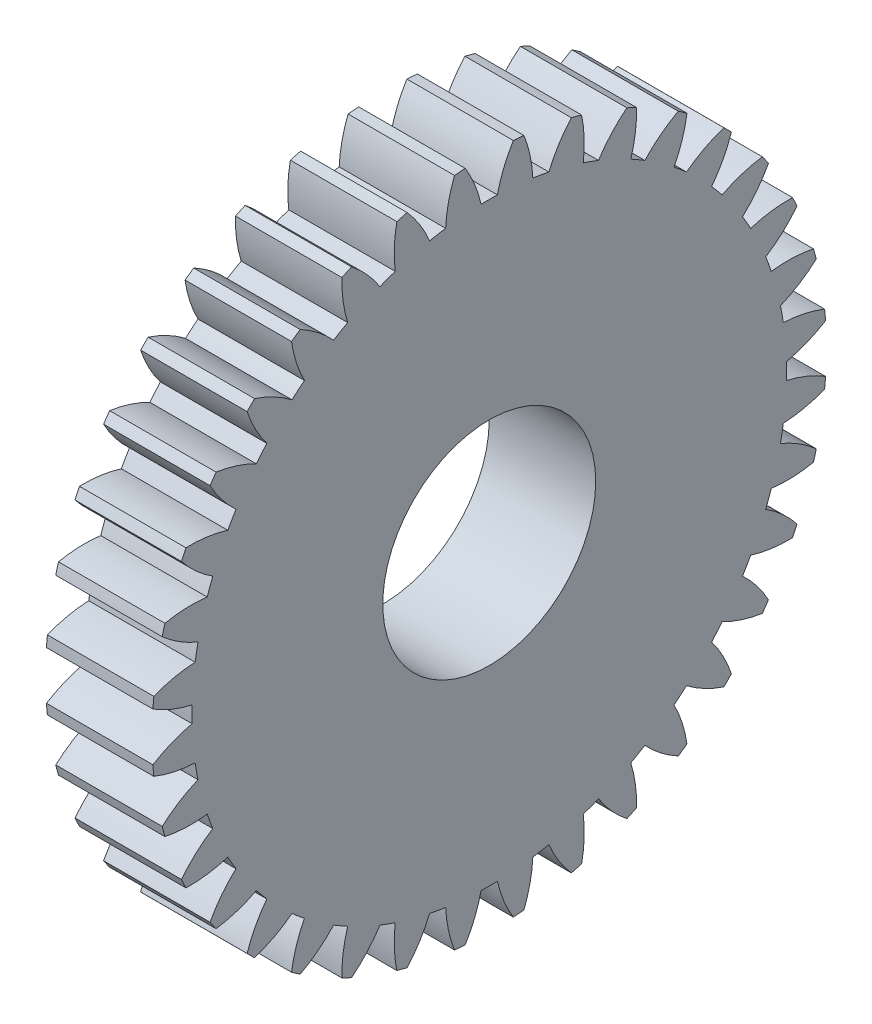
from build123d import *

# Parameters (mm, degrees)
BASPROSKE_W         = 6.35
BASPROSKE_H         = 20.108333333
TOOTHCUT_DEPTH      = 30.137821451
TEETHCUTS_COUNT     = 36
TEETHCUTS_ANGLE     = 350
BORSKE_R            = 9.525
BORE_DEPTH          = 50.8000508
SKETCH1_R           = 9.525
SKETCH1_R_2         = 6.35
BOSS_EXTRUDE1_DEPTH = 6.35


with BuildPart() as part:
    # BasProSke → Base-Revolve (revolve)
    with BuildSketch(Plane(origin=(0, 0, 0), x_dir=(1, 0, 0), z_dir=(0, 1, 0)), mode=Mode.PRIVATE) as base_revolve_sk:
        with Locations((3.175, 10.054166667)):
            Rectangle(BASPROSKE_W, BASPROSKE_H)
    revolve(base_revolve_sk.sketch.rotate(Axis((-10, 0, 0), (1, 0, 0)), 180), axis=Axis((-10, 0, 0), (1, 0, 0)))

    # TooCutSke → ToothCut (cut, through all)
    with BuildSketch(Plane(origin=(0, 0, 0), x_dir=(0, 0, -1), z_dir=(1, 0, 0))):
        with BuildLine():
            ThreePointArc((0.485894828, 17.722540418), (0, 17.7292), (-0.485894828, 17.722540418))
            ThreePointArc((-0.485894828, 17.722540418), (-0.869820886, 18.942611253), (-1.452410194, 20.081277912))
            ThreePointArc((-1.452410194, 20.081277912), (0, 20.133733333), (1.452410194, 20.081277912))
            ThreePointArc((1.452410194, 20.081277912), (0.869820886, 18.942611253), (0.485894828, 17.722540418))
        make_face()
    toothcut = extrude(amount=TOOTHCUT_DEPTH, mode=Mode.SUBTRACT)

    # TeethCuts: ToothCut ×36 about axis
    teethcuts_axis = Axis((-10, 0, 0), (1, 0, 0))
    for i in range(1, TEETHCUTS_COUNT):
        add(toothcut.rotate(teethcuts_axis, i * TEETHCUTS_ANGLE / (TEETHCUTS_COUNT - 1)), mode=Mode.SUBTRACT)

    # BorSke → Bore (cut, symmetric)
    with BuildSketch(Plane(origin=(0, 0, 0), x_dir=(0, 0, -1), z_dir=(1, 0, 0))):
        with Locations(Location((0, 0, 0), (0, 0, 180))):
            Circle(BORSKE_R)
    extrude(amount=BORE_DEPTH, both=True, mode=Mode.SUBTRACT)

    # Sketch1 → Boss-Extrude1 (add)
    with BuildSketch(Plane(origin=(6.35, 0, 0), x_dir=(0, 0, -1), z_dir=(1, 0, 0))):
        Circle(SKETCH1_R)
        Circle(SKETCH1_R_2, mode=Mode.SUBTRACT)
    extrude(amount=-BOSS_EXTRUDE1_DEPTH)


solid = part.part
